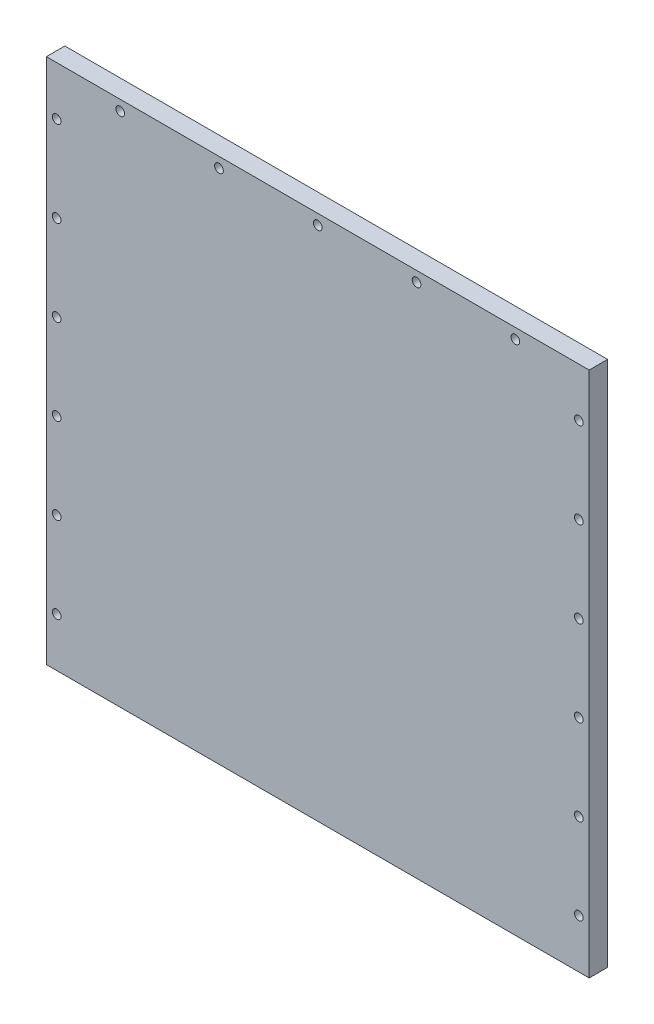
from build123d import *

# Parameters (mm, degrees)
SKETCH1_W               = 500
SKETCH1_H               = 485
BOSS_EXTRUDE1_DEPTH     = 17
CUT_EXTRUDE1_DEPTH      = 25
CUT_EXTRUDE1_DEPTH_BACK = 13
SKETCH2_R               = 4


with BuildPart() as part:
    # Sketch1 → Boss-Extrude1 (new body)
    with BuildSketch(Plane.XY):
        with Locations((0, 12.5)):
            Rectangle(SKETCH1_W, SKETCH1_H)
    extrude(amount=BOSS_EXTRUDE1_DEPTH)

    # Sketch2 → Cut-Extrude1 (cut, two sides: drawn at the far end of the back side and taken through both)
    with BuildSketch(Plane.XY.offset(17).offset(-CUT_EXTRUDE1_DEPTH_BACK)):
        with Locations((240.5, 210)):
            Circle(SKETCH2_R)
        with Locations((182, 245.5)):
            Circle(SKETCH2_R)
        with Locations((-240.5, 210)):
            Circle(SKETCH2_R)
        with Locations((-240.5, 131)):
            Circle(SKETCH2_R)
        with Locations((240.5, 131)):
            Circle(SKETCH2_R)
        with Locations((-240.5, 52)):
            Circle(SKETCH2_R)
        with Locations((240.5, 52)):
            Circle(SKETCH2_R)
        with Locations((-240.5, -27)):
            Circle(SKETCH2_R)
        with Locations((240.5, -27)):
            Circle(SKETCH2_R)
        with Locations((-240.5, -106)):
            Circle(SKETCH2_R)
        with Locations((240.5, -106)):
            Circle(SKETCH2_R)
        with Locations((-182, 245.5)):
            Circle(SKETCH2_R)
        with Locations((-240.5, -185)):
            Circle(SKETCH2_R)
        with Locations((91, 245.5)):
            Circle(SKETCH2_R)
        with Locations((0, 245.5)):
            Circle(SKETCH2_R)
        with Locations((-91, 245.5)):
            Circle(SKETCH2_R)
        with Locations((240.5, -185)):
            Circle(SKETCH2_R)
    extrude(amount=CUT_EXTRUDE1_DEPTH + CUT_EXTRUDE1_DEPTH_BACK, mode=Mode.SUBTRACT)


solid = part.part
